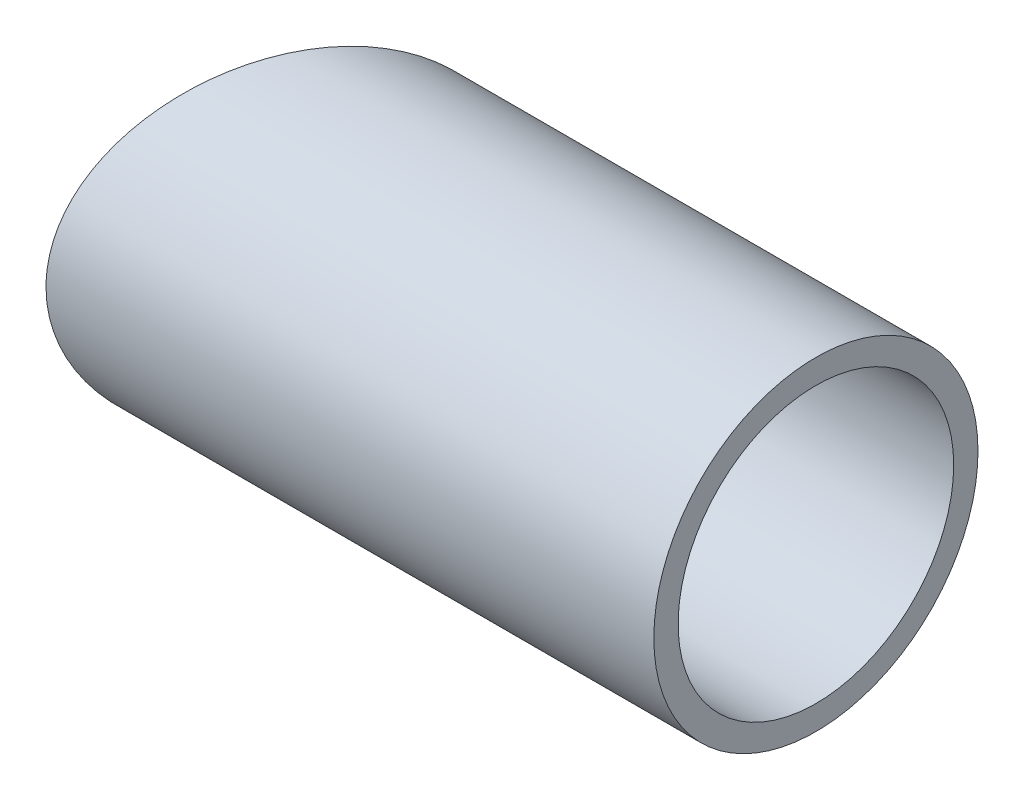
from build123d import *

# Parameters (mm, degrees)
SKETCH1_R               = 20
BOSS_EXTRUDE1_DEPTH     = 75
CUT_EXTRUDE2_DEPTH      = 81.156097709
CUT_EXTRUDE2_DEPTH_BACK = 81.156097709
SKETCH3_R               = 14.5
SKETCH4_R               = 17
CUT_EXTRUDE3_DEPTH      = 25
CUT_EXTRUDE4_DEPTH      = 81.156097709
CUT_EXTRUDE4_DEPTH_BACK = 81.156097709
SKETCH5_R               = 426.5


with BuildPart() as part:
    # Sketch1 → Boss-Extrude1 (new body)
    with BuildSketch(Plane(origin=(0, 0, 0), x_dir=(0, 0, -1), z_dir=(1, 0, 0))):
        Circle(SKETCH1_R)
    extrude(amount=BOSS_EXTRUDE1_DEPTH)

    # Sketch3 → Cut-Extrude2 (cut, two sides: drawn at the far end of the back side and taken through both)
    with BuildSketch(Plane(origin=(75, 0, 0), x_dir=(0, 0, -1), z_dir=(1, 0, 0)).offset(-CUT_EXTRUDE2_DEPTH_BACK)):
        Circle(SKETCH3_R)
    extrude(amount=CUT_EXTRUDE2_DEPTH + CUT_EXTRUDE2_DEPTH_BACK, mode=Mode.SUBTRACT)

    # Sketch4 → Cut-Extrude3 (cut)
    with BuildSketch(Plane(origin=(75, 0, 0), x_dir=(0, 0, -1), z_dir=(1, 0, 0))):
        Circle(SKETCH4_R)
    extrude(amount=-CUT_EXTRUDE3_DEPTH, mode=Mode.SUBTRACT)

    # Sketch5 → Cut-Extrude4 (cut, two sides: drawn at the far end of the back side and taken through both)
    with BuildSketch(Plane(origin=(0, 0, 0), x_dir=(1, 0, 0), z_dir=(0, 1, 0)).offset(-CUT_EXTRUDE4_DEPTH_BACK)):
        with Locations((-376.699150517, 180)):
            Circle(SKETCH5_R)
    extrude(amount=CUT_EXTRUDE4_DEPTH + CUT_EXTRUDE4_DEPTH_BACK, mode=Mode.SUBTRACT)


solid = part.part
